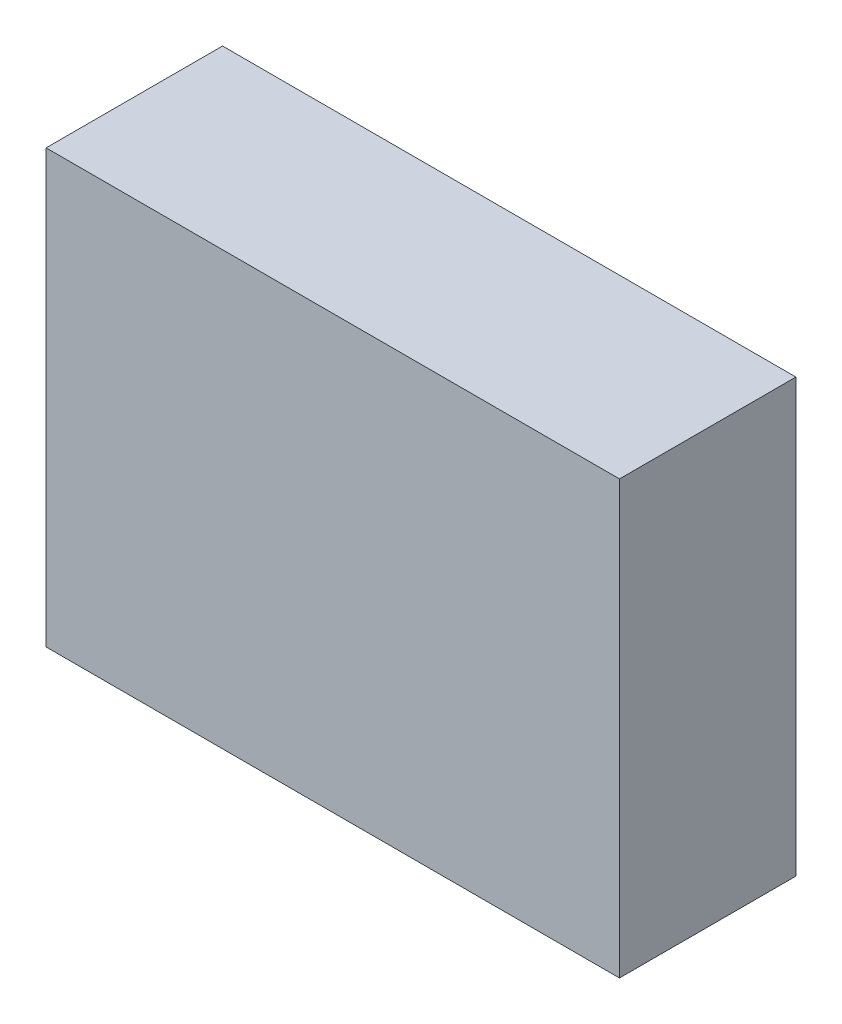
from build123d import *

# Parameters (mm, degrees)
SKETCH_1_W      = 65
SKETCH_1_H      = 49
EXTRUDE_1_DEPTH = 20


with BuildPart() as part:
    # 草图1 → 凸台-拉伸1 (new body)
    with BuildSketch(Plane.XY):
        with Locations((7.5, 4.5)):
            Rectangle(SKETCH_1_W, SKETCH_1_H)
    extrude(amount=EXTRUDE_1_DEPTH)


solid = part.part
